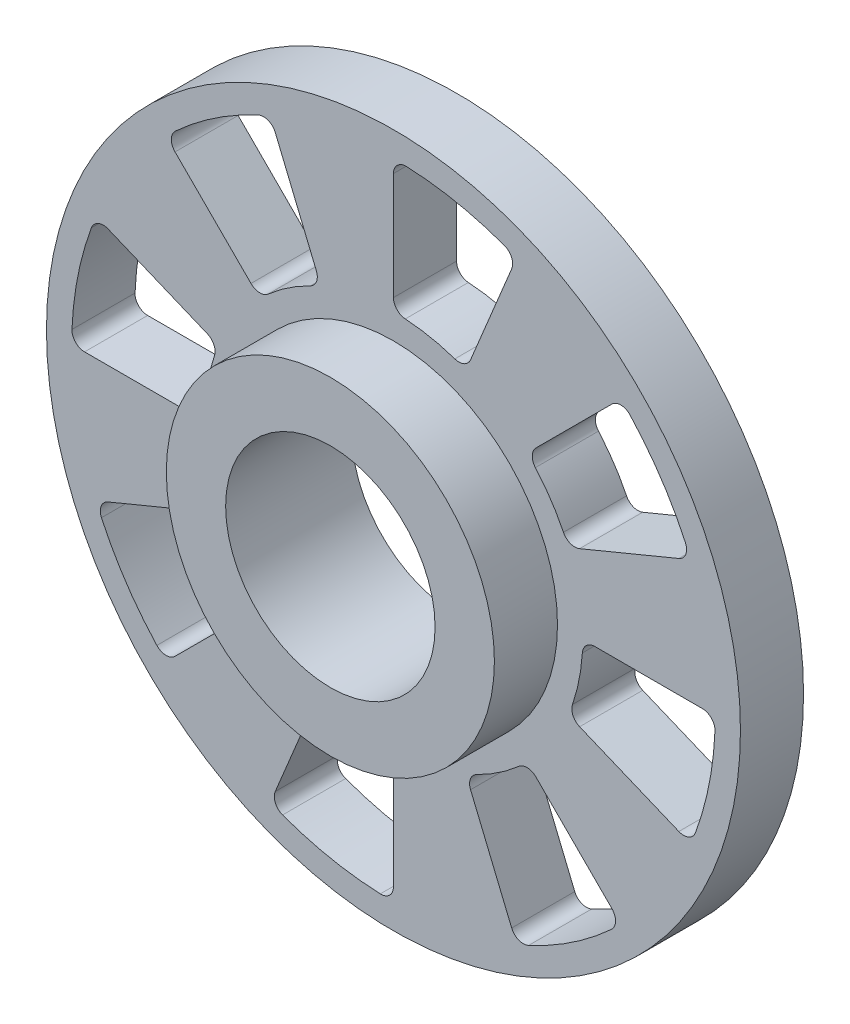
from build123d import *

# Parameters (mm, degrees)
SKETCH1_R                = 13.75
SKETCH1_R_2              = 4.15
BOSS_EXTRUDE1_DEPTH      = 2.5
SKETCH2_R                = 6.5
SKETCH2_R_2              = 4.15
BOSS_EXTRUDE2_DEPTH      = 2.5
CUT_EXTRUDE1_DEPTH       = 21.077973005
FILLET1_R                = 0.5
CIRPATTERN1_COUNT        = 8
FILLET1_OF_CIRPATTERN1_R = 0.5


with BuildPart() as part:
    # Sketch1 → Boss-Extrude1 (new body)
    with BuildSketch(Plane.XY):
        Circle(SKETCH1_R)
        Circle(SKETCH1_R_2, mode=Mode.SUBTRACT)
    extrude(amount=BOSS_EXTRUDE1_DEPTH)

    # Sketch2 → Boss-Extrude2 (add)
    with BuildSketch(Plane.XY.offset(2.5)):
        Circle(SKETCH2_R)
        Circle(SKETCH2_R_2, mode=Mode.SUBTRACT)
    extrude(amount=BOSS_EXTRUDE2_DEPTH)

    # Sketch5 → Cut-Extrude1 (cut, through all)
    with BuildSketch(Plane.XY):
        with BuildLine():
            Line((0, 12.75), (0, 7.5))
            ThreePointArc((0, 7.5), (1.463177415, 7.355889603), (2.870125743, 6.929096494))
            Line((2.870125743, 6.929096494), (4.879213763, 11.77946404))
            ThreePointArc((4.879213763, 11.77946404), (2.487401606, 12.505012325), (0, 12.75))
        make_face()
    cut_extrude1 = extrude(amount=CUT_EXTRUDE1_DEPTH, mode=Mode.SUBTRACT)

    # Fillet1
    fillet1_edges = [part.edges().sort_by_distance(p)[0] for p in [
        (0, 7.5, 1.25),
        (2.870125743, 6.929096494, 1.25),
        (4.879213763, 11.77946404, 1.25),
        (0, 12.75, 1.25),
    ]]
    fillet(fillet1_edges, radius=FILLET1_R)

    # CirPattern1: Cut-Extrude1 ×8 about axis
    cirpattern1_axis = Axis((0, 0, 0), (0, 0, 1))
    for i in range(1, CIRPATTERN1_COUNT):
        add(cut_extrude1.rotate(cirpattern1_axis, i * 360 / CIRPATTERN1_COUNT), mode=Mode.SUBTRACT)

    # Fillet1 of CirPattern1
    fillet1_of_cirpattern1_edges = [part.edges().sort_by_distance(p)[0] for p in [
        (-5.303300859, 5.303300859, 1.25),
        (-2.870125743, 6.929096494, 1.25),
        (-4.879213763, 11.77946404, 1.25),
        (-9.01561146, 9.01561146, 1.25),
        (-7.5, 0, 1.25),
        (-6.929096494, 2.870125743, 1.25),
        (-11.77946404, 4.879213763, 1.25),
        (-12.75, 0, 1.25),
        (-5.303300859, -5.303300859, 1.25),
        (-6.929096494, -2.870125743, 1.25),
        (-11.77946404, -4.879213763, 1.25),
        (-9.01561146, -9.01561146, 1.25),
        (0, -7.5, 1.25),
        (-2.870125743, -6.929096494, 1.25),
        (-4.879213763, -11.77946404, 1.25),
        (0, -12.75, 1.25),
        (5.303300859, -5.303300859, 1.25),
        (2.870125743, -6.929096494, 1.25),
        (4.879213763, -11.77946404, 1.25),
        (9.01561146, -9.01561146, 1.25),
        (7.5, 0, 1.25),
        (6.929096494, -2.870125743, 1.25),
        (11.77946404, -4.879213763, 1.25),
        (12.75, 0, 1.25),
        (5.303300859, 5.303300859, 1.25),
        (6.929096494, 2.870125743, 1.25),
        (11.77946404, 4.879213763, 1.25),
        (9.01561146, 9.01561146, 1.25),
    ]]
    fillet(fillet1_of_cirpattern1_edges, radius=FILLET1_OF_CIRPATTERN1_R)


solid = part.part
